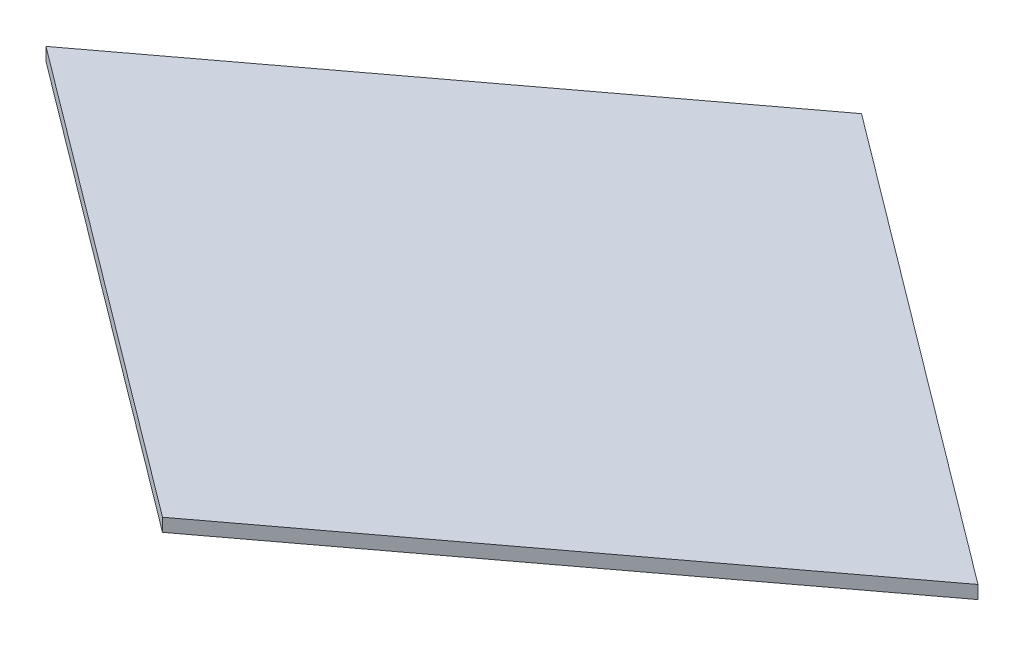
from build123d import *

# Parameters (mm, degrees)
BOSS_EXTRUDE1_DEPTH = 5.63


with BuildPart() as part:
    # Sketch1 → Boss-Extrude1 (new body)
    with BuildSketch(Plane(origin=(0, 0, 0), x_dir=(1, 0, 0), z_dir=(0, 1, 0))):
        Polygon((0, 150), (200, 0), (0, -150), (-200, 0), align=None)
    extrude(amount=BOSS_EXTRUDE1_DEPTH)


solid = part.part
